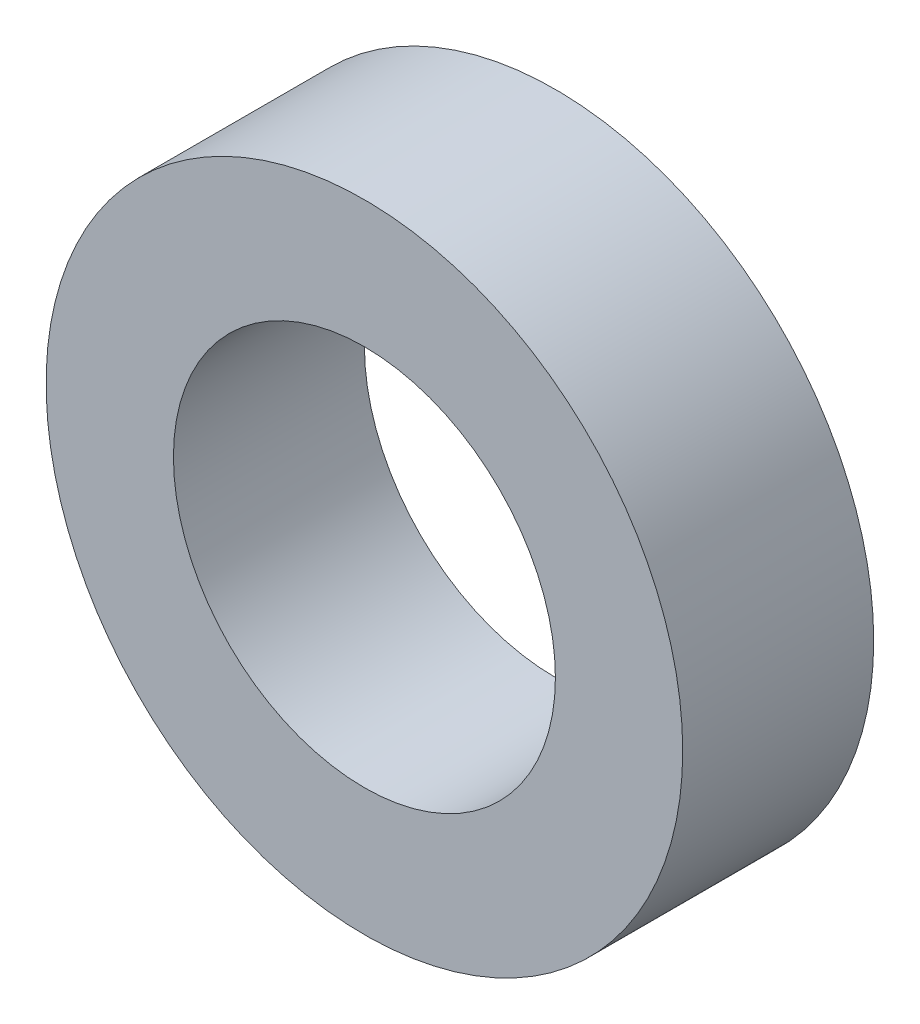
from build123d import *

# Parameters (mm, degrees)
ESQUISSE1_R          = 10
ESQUISSE1_R_2        = 6
BASE_EXTRUSION_DEPTH = 6


with BuildPart() as part:
    # Esquisse1 → Base-Extrusion (new body)
    with BuildSketch(Plane.XY):
        Circle(ESQUISSE1_R)
        Circle(ESQUISSE1_R_2, mode=Mode.SUBTRACT)
    extrude(amount=BASE_EXTRUSION_DEPTH)


solid = part.part
